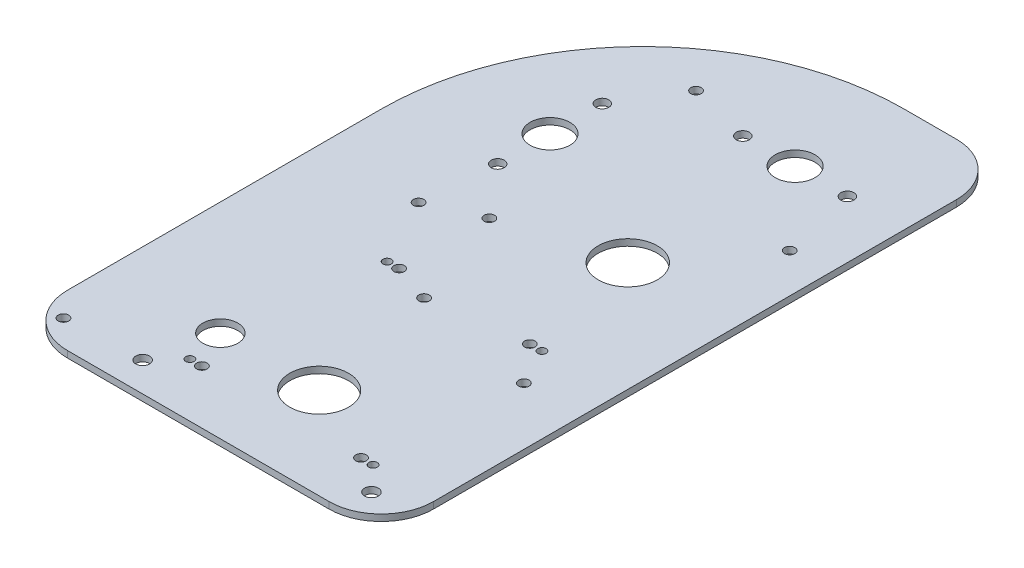
from build123d import *

# Parameters (mm, degrees)
SKETCH1_W                  = 355.6
SKETCH1_H                  = 77.724
BOSS_EXTRUDE1_DEPTH        = 22.225
SKETCH2_W                  = 74.549
SKETCH2_H                  = 19.05
CUT_EXTRUDE1_DEPTH         = 364.67400769
SKETCH3_W                  = 25.4
SKETCH3_H                  = 3.937
CUT_EXTRUDE2_DEPTH         = 817.444922817
SKETCH4_W                  = 330.2
SKETCH4_H                  = 3.175
BOSS_EXTRUDE2_DEPTH        = 15.875
SKETCH5_W                  = 69.85
SKETCH5_H                  = 3.175
BOSS_EXTRUDE3_DEPTH        = 457.2
SKETCH6_W                  = 330.2
SKETCH6_H                  = 3.175
BOSS_EXTRUDE4_DEPTH        = 3.937
SKETCH7_W                  = 330.2
SKETCH7_H                  = 3.175
BOSS_EXTRUDE5_DEPTH        = 15.875
SKETCH8_W                  = 355.6
SKETCH8_H                  = 3.175
BOSS_EXTRUDE6_DEPTH        = 3.937
SKETCH9_W                  = 355.6
SKETCH9_H                  = 3.175
BOSS_EXTRUDE7_DEPTH        = 19.05
SKETCH10_W                 = 76.358809824
SKETCH10_H                 = 3.175
BOSS_EXTRUDE8_DEPTH        = 27.432
SKETCH11_W                 = 124.052954744
SKETCH11_H                 = 3.175
BOSS_EXTRUDE9_DEPTH        = 19.05
DRAFT1_ANGLE               = 30
DRAFT2_ANGLE               = 19
M20_CLEARANCE_HOLE1_D      = 22.225
M20_CLEARANCE_HOLE1_DEPTH  = 19.050025
HOLE1_D                    = 8.128
HOLE1_DEPTH                = 22.225
M25_CLEARANCE_HOLE1_D      = 28.575
M25_CLEARANCE_HOLE1_DEPTH  = 22.225
M3_CLEARANCE_HOLE1_D       = 3.571875
M3_CLEARANCE_HOLE1_DEPTH   = 22.225
M2_CLEARANCE_HOLE1_D       = 2.54
M2_CLEARANCE_HOLE1_DEPTH   = 22.225
M3_5_CLEARANCE_HOLE1_D     = 4.064
M3_5_CLEARANCE_HOLE1_DEPTH = 22.225
HOLE2_D                    = 5.08
HOLE2_DEPTH                = 22.225
M25_CLEARANCE_HOLE2_D      = 28.575
M25_CLEARANCE_HOLE2_DEPTH  = 19.050025
HOLE3_D                    = 5.1054
HOLE3_DEPTH                = 19.050025
HOLE4_D                    = 8.128
HOLE4_DEPTH                = 19.050025
M3_CLEARANCE_HOLE2_D       = 3.571875
M3_CLEARANCE_HOLE2_DEPTH   = 19.050025
M6_CLEARANCE_HOLE1_D       = 6.7056
M6_CLEARANCE_HOLE1_DEPTH   = 22.225
M6_CLEARANCE_HOLE2_D       = 6.7056
M6_CLEARANCE_HOLE2_DEPTH   = 101.219
M5_CLEARANCE_HOLE1_D       = 5.334
M5_CLEARANCE_HOLE1_DEPTH   = 92.837
CHAMFER1_SIZE              = 3.175
FILLET1_R                  = 0.762
FILLET2_R                  = 3.175
FILLET3_R                  = 3.937
CUT_EXTRUDE3_DEPTH         = 819.902667079
CUT_EXTRUDE3_DEPTH_BACK    = 819.902667079
BOSS_EXTRUDE10_START       = -3.175
SKETCH45_W                 = 177.8
SKETCH45_H                 = 304.8
SKETCH45_R                 = 2.54
SKETCH45_R_2               = 14.2875
SKETCH45_R_3               = 2.032
SKETCH45_R_4               = 3.3528
BOSS_EXTRUDE10_DEPTH       = 3.175
SKETCH61_R                 = 9.652
SKETCH61_R_2               = 14.351
CUT_EXTRUDE16_DEPTH        = 556.389125447
SKETCH59_R                 = 9.5
CUT_EXTRUDE17_DEPTH        = 556.389125447
SKETCH62_R                 = 3.175
CUT_EXTRUDE18_DEPTH        = 556.389125447
CUT_EXTRUDE19_DEPTH        = 556.389125447
SKETCH70_R                 = 9.5
SKETCH70_R_2               = 8.5
BOSS_EXTRUDE15_DEPTH       = 3.175
SKETCH73_R                 = 2.54
CUT_EXTRUDE21_DEPTH        = 556.389125447
FILLET9_R                  = 25.4
CUT_EXTRUDE23_DEPTH        = 556.389125447
CUT_EXTRUDE23_DEPTH_BACK   = 556.389125447
SKETCH76_R                 = 2.54


with BuildPart() as part:
    # Sketch1 → Boss-Extrude1 (new body)
    with BuildSketch(Plane(origin=(0, 3.175, 0), x_dir=(1, 0, 0), z_dir=(0, 1, 0))):
        with Locations((635, 34.925)):
            Rectangle(SKETCH1_W, SKETCH1_H)
    extrude(amount=-BOSS_EXTRUDE1_DEPTH)

    # Sketch2 → Cut-Extrude1 (cut, through all)
    with BuildSketch(Plane(origin=(812.8, 0, 0), x_dir=(0, 0, -1), z_dir=(1, 0, 0))):
        with Locations((33.3375, -9.525)):
            Rectangle(SKETCH2_W, SKETCH2_H)
    extrude(amount=-CUT_EXTRUDE1_DEPTH, mode=Mode.SUBTRACT)

    # Sketch3 → Cut-Extrude2 (cut, through all)
    with BuildSketch(Plane(origin=(0, 3.175, 0), x_dir=(-1, 0, 0), z_dir=(0, 1, 0))):
        with Locations((-469.9, 1.9685)):
            Rectangle(SKETCH3_W, SKETCH3_H)
    extrude(amount=-CUT_EXTRUDE2_DEPTH, mode=Mode.SUBTRACT)

    # Sketch4 → Boss-Extrude2 (add)
    with BuildSketch(Plane(origin=(0, 3.175, 0), x_dir=(-1, 0, 0), z_dir=(0, 1, 0))):
        with Locations((-647.7, 2.3495)):
            Rectangle(SKETCH4_W, SKETCH4_H)
    extrude(amount=BOSS_EXTRUDE2_DEPTH)

    # Sketch5 → Boss-Extrude3 (add)
    with BuildSketch(Plane.ZY.offset(-457.2)):
        with Locations((-34.925, 1.5875)):
            Rectangle(SKETCH5_W, SKETCH5_H)
    extrude(amount=BOSS_EXTRUDE3_DEPTH)

    # Sketch6 → Boss-Extrude4 (add)
    with BuildSketch(Plane.XY):
        with Locations((165.1, 1.5875)):
            Rectangle(SKETCH6_W, SKETCH6_H)
    extrude(amount=BOSS_EXTRUDE4_DEPTH)

    # Sketch7 → Boss-Extrude5 (add)
    with BuildSketch(Plane(origin=(0, 3.175, 0), x_dir=(-1, 0, 0), z_dir=(0, 1, 0))):
        with Locations((-165.1, 2.3495)):
            Rectangle(SKETCH7_W, SKETCH7_H)
    extrude(amount=BOSS_EXTRUDE5_DEPTH)

    # Sketch8 → Boss-Extrude6 (add)
    with BuildSketch(Plane(origin=(0, 0, -69.85), x_dir=(-1, 0, 0), z_dir=(0, 0, -1))):
        with Locations((-177.8, 1.5875)):
            Rectangle(SKETCH8_W, SKETCH8_H)
    extrude(amount=BOSS_EXTRUDE6_DEPTH)

    # Sketch9 → Boss-Extrude7 (add)
    with BuildSketch(Plane.XZ):
        with Locations((177.8, -72.1995)):
            Rectangle(SKETCH9_W, SKETCH9_H)
    extrude(amount=BOSS_EXTRUDE7_DEPTH)

    # Sketch10 → Boss-Extrude8 (add)
    with BuildSketch(Plane(origin=(0, 0, -69.85), x_dir=(-1, 0, 0), z_dir=(0, 0, -1))):
        with Locations((-406.4, 1.5875)):
            Rectangle(SKETCH10_W, SKETCH10_H)
    extrude(amount=BOSS_EXTRUDE8_DEPTH)

    # Sketch11 → Boss-Extrude9 (add)
    with BuildSketch(Plane.XY):
        with Locations((406.4, 1.5875)):
            Rectangle(SKETCH11_W, SKETCH11_H)
    extrude(amount=BOSS_EXTRUDE9_DEPTH)

    # Draft1
    draft1_faces = [part.faces().sort_by_distance(p)[0] for p in [
        (344.373522628, 1.5875, 9.525),
        (468.426477372, 1.5875, 9.525),
    ]]
    draft(draft1_faces, Plane.XY.offset(19.05), DRAFT1_ANGLE)

    # Draft2
    draft2_faces = [part.faces().sort_by_distance(p)[0] for p in [
        (368.220595088, 1.5875, -83.566),
        (444.579404912, 1.5875, -83.566),
    ]]
    draft(draft2_faces, Plane(origin=(0, 0, -97.282), x_dir=(-1, 0, 0), z_dir=(0, 0, -1)), DRAFT2_ANGLE)

    # M20 Clearance Hole1
    with Locations(Plane(origin=(0, 0, 0), x_dir=(-1, 0, 0), z_dir=(0, -1, 0))):
        with Locations((-624.254637168, 36.83)):
            Hole(M20_CLEARANCE_HOLE1_D / 2, depth=M20_CLEARANCE_HOLE1_DEPTH)

    # Hole1
    with Locations(Plane(origin=(0, 3.175, 0), x_dir=(1, 0, 0), z_dir=(0, 1, 0))):
        with Locations((229.261562832, 36.83), (229.261562832, 62.23), (229.261562832, 11.43)):
            Hole(HOLE1_D / 2, depth=HOLE1_DEPTH)

    # M25 Clearance Hole1
    with Locations(Plane(origin=(0, 3.175, 0), x_dir=(1, 0, 0), z_dir=(0, 1, 0))):
        with Locations((147.829162832, 36.83)):
            Hole(M25_CLEARANCE_HOLE1_D / 2, depth=M25_CLEARANCE_HOLE1_DEPTH)

    # M3 Clearance Hole1
    with Locations(Plane(origin=(0, 3.175, 0), x_dir=(1, 0, 0), z_dir=(0, 1, 0))):
        with Locations((120.600362832, 65.405), (120.600362832, 8.255), (237.440362832, 8.255), (237.440362832, 65.405)):
            Hole(M3_CLEARANCE_HOLE1_D / 2, depth=M3_CLEARANCE_HOLE1_DEPTH)

    # M2 Clearance Hole1
    with Locations(Plane(origin=(0, 3.175, 0), x_dir=(1, 0, 0), z_dir=(0, 1, 0))):
        with Locations((101.6, 3.175), (101.6, 66.675), (50.8, 66.675), (50.8, 3.175), (762, 66.675), (762, 3.175), (711.2, 3.175), (711.2, 66.675)):
            Hole(M2_CLEARANCE_HOLE1_D / 2, depth=M2_CLEARANCE_HOLE1_DEPTH)

    # M3.5 Clearance Hole1
    with Locations(Plane(origin=(0, 3.175, 0), x_dir=(1, 0, 0), z_dir=(0, 1, 0))):
        with Locations((443.992, 87.85352), (368.808, 87.85352), (361.9119, -1.03886), (450.8881, -1.03886)):
            Hole(M3_5_CLEARANCE_HOLE1_D / 2, depth=M3_5_CLEARANCE_HOLE1_DEPTH)

    # Hole2
    with Locations(Plane(origin=(0, 3.175, 0), x_dir=(1, 0, 0), z_dir=(0, 1, 0))):
        with Locations((438.15, 87.85352), (374.65, 87.85352), (445.0461, -1.03886), (367.7539, -1.03886), (115.520362832, 65.405), (115.520362832, 8.255), (242.520362832, 8.255), (242.520362832, 65.405)):
            Hole(HOLE2_D / 2, depth=HOLE2_DEPTH)

    # M25 Clearance Hole2
    with Locations(Plane(origin=(0, 0, 0), x_dir=(-1, 0, 0), z_dir=(0, -1, 0))):
        with Locations((-406.4, 17.272), (-664.970837168, 36.83)):
            Hole(M25_CLEARANCE_HOLE2_D / 2, depth=M25_CLEARANCE_HOLE2_DEPTH)

    # Hole3
    with Locations(Plane(origin=(0, 0, 0), x_dir=(-1, 0, 0), z_dir=(0, -1, 0))):
        with Locations((-570.279637168, 8.255), (-570.279637168, 65.405), (-697.279637168, 65.405), (-697.279637168, 8.255)):
            Hole(HOLE3_D / 2, depth=HOLE3_DEPTH)

    # Hole4
    with Locations(Plane(origin=(0, 0, 0), x_dir=(-1, 0, 0), z_dir=(0, -1, 0))):
        with Locations((-583.538437168, 11.43), (-583.538437168, 36.83), (-583.538437168, 62.23)):
            Hole(HOLE4_D / 2, depth=HOLE4_DEPTH)

    # M3 Clearance Hole2
    with Locations(Plane(origin=(0, 0, 0), x_dir=(-1, 0, 0), z_dir=(0, -1, 0))):
        with Locations((-692.199637168, 8.255), (-692.199637168, 65.405), (-575.359637168, 65.405), (-575.359637168, 8.255)):
            Hole(M3_CLEARANCE_HOLE2_D / 2, depth=M3_CLEARANCE_HOLE2_DEPTH)

    # M6 Clearance Hole1
    with Locations(Plane(origin=(0, 3.175, 0), x_dir=(1, 0, 0), z_dir=(0, 1, 0))):
        with Locations((612.775, 10.287), (498.475, 10.287), (314.325, 10.287), (200.025, 10.287), (628.319218584, 61.976), (184.480781416, 61.976), (690.88, 15.875), (739.902, 9.525), (121.92, 15.875), (72.898, 9.525), (298.874532383, 17.547282407), (513.925467617, 17.547282407), (165.1, 14.732), (266.7, 14.732), (546.1, 14.732), (647.7, 14.732), (330.2, 61.722), (279.4, 61.722), (139.7, 61.722), (25.4, 61.722), (482.6, 61.722), (533.4, 61.722), (673.1, 61.722), (787.4, 61.722), (6.35, 39.497), (806.45, 39.497), (350.8375, -12.8905), (461.9625, -12.8905)):
            Hole(M6_CLEARANCE_HOLE1_D / 2, depth=M6_CLEARANCE_HOLE1_DEPTH)

    # M6 Clearance Hole2
    with Locations(Plane.XY.offset(3.937)):
        with Locations((495.3, 12.7), (520.7, 12.7), (546.1, 12.7), (571.5, 12.7), (596.9, 12.7), (622.3, 12.7), (647.7, 12.7), (673.1, 12.7), (698.5, 12.7), (723.9, 12.7), (749.3, 12.7), (774.7, 12.7), (800.1, 12.7), (317.5, 12.7), (292.1, 12.7), (266.7, 12.7), (241.3, 12.7), (215.9, 12.7), (190.5, 12.7), (165.1, 12.7), (139.7, 12.7), (114.3, 12.7), (88.9, 12.7), (63.5, 12.7), (12.7, 12.7), (38.1, 12.7)):
            Hole(M6_CLEARANCE_HOLE2_D / 2, depth=M6_CLEARANCE_HOLE2_DEPTH)

    # M5 Clearance Hole1
    with Locations(Plane(origin=(0, 0, -73.787), x_dir=(-1, 0, 0), z_dir=(0, 0, -1))):
        with Locations((-469.9, -12.7), (-495.3, -12.7), (-520.7, -12.7), (-546.1, -12.7), (-571.5, -12.7), (-596.9, -12.7), (-622.3, -12.7), (-647.7, -12.7), (-673.1, -12.7), (-698.5, -12.7), (-723.9, -12.7), (-749.3, -12.7), (-774.7, -12.7), (-800.1, -12.7), (-342.9, -12.7), (-317.5, -12.7), (-292.1, -12.7), (-266.7, -12.7), (-241.3, -12.7), (-215.9, -12.7), (-190.5, -12.7), (-165.1, -12.7), (-139.7, -12.7), (-114.3, -12.7), (-88.9, -12.7), (-63.5, -12.7), (-38.1, -12.7), (-12.7, -12.7)):
            Hole(M5_CLEARANCE_HOLE1_D / 2, depth=M5_CLEARANCE_HOLE1_DEPTH)

    # Chamfer1
    chamfer1_edges = [part.edges().sort_by_distance(p)[0] for p in [
        (482.6, 19.05, 2.3495),
        (0, 19.05, 2.3495),
        (812.8, 19.05, 2.3495),
        (812.8, -19.05, -72.1995),
        (457.2, -19.05, -72.1995),
        (0, -19.05, -72.1995),
        (330.2, 19.05, 2.3495),
        (355.6, -19.05, -72.1995),
    ]]
    chamfer(chamfer1_edges, length=CHAMFER1_SIZE)

    # Fillet1
    fillet1_edges = [part.edges().sort_by_distance(p)[0] for p in [
        (647.7, 3.175, 0.762),
        (177.8, 0, -70.612),
        (635, 0, -70.612),
        (165.1, 3.175, 0.762),
    ]]
    fillet(fillet1_edges, radius=FILLET1_R)

    # Fillet2
    fillet2_edges = [part.edges().sort_by_distance(p)[0] for p in [
        (368.220595088, 1.5875, -97.282),
        (333.375, 1.5875, 0),
        (344.373522628, 1.5875, 19.05),
        (444.579404912, 1.5875, -97.282),
        (358.775, 1.5875, -69.85),
        (479.425, 1.5875, 0),
        (468.426477372, 1.5875, 19.05),
        (454.025, 1.5875, -69.85),
    ]]
    fillet(fillet2_edges, radius=FILLET2_R)

    # Fillet3
    fillet3_edges = [part.edges().sort_by_distance(p)[0] for p in [
        (165.1, 0, 3.937),
        (647.7, 0, 3.937),
        (635, 3.175, -73.787),
        (177.8, 3.175, -73.787),
    ]]
    fillet(fillet3_edges, radius=FILLET3_R)

    # Sketch44 → Cut-Extrude3 (cut, two sides: drawn at the far end of the back side and taken through both)
    with BuildSketch(Plane(origin=(0, 3.175, 0), x_dir=(1, 0, 0), z_dir=(0, 1, 0)).offset(-CUT_EXTRUDE3_DEPTH_BACK)):
        Polygon((367.483279101, 95.14067889), (343.456979076, -17.4625), (339.564298226, -35.70618453), (-19.786749283, -35.70618453), (-19.786749283, 120.609234526), (367.483279101, 120.609234526), align=None)
        Polygon((445.316720899, 95.14067889), (445.316720899, 120.609234526), (832.586749283, 120.609234526), (832.586749283, -35.70618453), (473.235701774, -35.70618453), (469.343020924, -17.4625), align=None)
    extrude(amount=CUT_EXTRUDE3_DEPTH + CUT_EXTRUDE3_DEPTH_BACK, mode=Mode.SUBTRACT)

    # Sketch45 → Boss-Extrude10 (add)
    with BuildSketch(Plane(origin=(0, 3.175, 0), x_dir=(1, 0, 0), z_dir=(0, 1, 0)).offset(BOSS_EXTRUDE10_START)):
        with Locations((392.1125, 125.222)):
            Rectangle(SKETCH45_W, SKETCH45_H)
        with Locations(Location((374.65, 87.85352, 0), (0, 0, 270))):
            Circle(SKETCH45_R, mode=Mode.SUBTRACT)
        with Locations(Location((406.4, 17.272, 0), (0, 0, 90))):
            Circle(SKETCH45_R_2, mode=Mode.SUBTRACT)
        with Locations(Location((368.808, 87.85352, 0), (0, 0, 270))):
            Circle(SKETCH45_R_3, mode=Mode.SUBTRACT)
        with Locations(Location((438.15, 87.85352, 0), (0, 0, 270))):
            Circle(SKETCH45_R, mode=Mode.SUBTRACT)
        with Locations(Location((443.992, 87.85352, 0), (0, 0, 270))):
            Circle(SKETCH45_R_3, mode=Mode.SUBTRACT)
        with Locations(Location((445.0461, -1.03886, 0), (0, 0, 270))):
            Circle(SKETCH45_R, mode=Mode.SUBTRACT)
        with Locations(Location((450.8881, -1.03886, 0), (0, 0, 270))):
            Circle(SKETCH45_R_3, mode=Mode.SUBTRACT)
        with Locations(Location((461.9625, -12.8905, 0), (0, 0, 270))):
            Circle(SKETCH45_R_4, mode=Mode.SUBTRACT)
        with Locations(Location((367.7539, -1.03886, 0), (0, 0, 270))):
            Circle(SKETCH45_R, mode=Mode.SUBTRACT)
        with Locations(Location((361.9119, -1.03886, 0), (0, 0, 270))):
            Circle(SKETCH45_R_3, mode=Mode.SUBTRACT)
        with Locations(Location((350.8375, -12.8905, 0), (0, 0, 270))):
            Circle(SKETCH45_R_4, mode=Mode.SUBTRACT)
    extrude(amount=BOSS_EXTRUDE10_DEPTH)

    # Sketch61 → Cut-Extrude16 (cut, through all)
    with BuildSketch(Plane(origin=(0, 3.175, 0), x_dir=(1, 0, 0), z_dir=(0, 1, 0))):
        with Locations(Location((354.59, 181.205026561, 0), (0, 0, 270))):
            Circle(SKETCH61_R)
        with Locations(Location((427.755496639, 227.083776561, 0), (0, 0, 270))):
            Circle(SKETCH61_R)
        with Locations(Location((427.755496639, 145.803776561, 0), (0, 0, 270))):
            Circle(SKETCH61_R_2)
    extrude(amount=-CUT_EXTRUDE16_DEPTH, mode=Mode.SUBTRACT)

    # Sketch59 → Cut-Extrude17 (cut, through all)
    with BuildSketch(Plane(origin=(0, 3.175, 0), x_dir=(1, 0, 0), z_dir=(0, 1, 0))):
        with Locations(Location((358.4, 17.272, 0), (0, 0, 270))):
            Circle(SKETCH59_R)
    extrude(amount=-CUT_EXTRUDE17_DEPTH, mode=Mode.SUBTRACT)

    # Sketch62 → Cut-Extrude18 (cut, through all)
    with BuildSketch(Plane(origin=(0, 3.175, 0), x_dir=(1, 0, 0), z_dir=(0, 1, 0))):
        with Locations(Location((354.59, 206.605026561, 0), (0, 0, 270))):
            Circle(SKETCH62_R)
        with Locations(Location((354.59, 155.805026561, 0), (0, 0, 270))):
            Circle(SKETCH62_R)
        with Locations(Location((402.355496639, 227.083776561, 0), (0, 0, 270))):
            Circle(SKETCH62_R)
        with Locations(Location((453.155496639, 227.083776561, 0), (0, 0, 270))):
            Circle(SKETCH62_R)
    extrude(amount=-CUT_EXTRUDE18_DEPTH, mode=Mode.SUBTRACT)

    # Sketch64 → Cut-Extrude19 (cut, through all)
    with BuildSketch(Plane(origin=(0, 3.175, 0), x_dir=(1, 0, 0), z_dir=(0, 1, 0))):
        with BuildLine():
            Line((303.2125, 150.622), (303.2125, 277.622))
            Line((303.2125, 277.622), (430.2125, 277.622))
            ThreePointArc((430.2125, 277.622), (340.409938789, 240.424561211), (303.2125, 150.622))
        make_face()
    extrude(amount=-CUT_EXTRUDE19_DEPTH, mode=Mode.SUBTRACT)

    # Sketch70 → Boss-Extrude15 (add)
    with BuildSketch(Plane(origin=(0, 3.175, 0), x_dir=(1, 0, 0), z_dir=(0, 1, 0))):
        with Locations((358.4, 17.272)):
            Circle(SKETCH70_R)
        with Locations(Location((358.4, 17.272, 0), (0, 0, 270))):
            Circle(SKETCH70_R_2, mode=Mode.SUBTRACT)
    extrude(amount=-BOSS_EXTRUDE15_DEPTH)

    # Sketch73 → Cut-Extrude21 (cut, through all)
    with BuildSketch(Plane(origin=(0, 3.175, 0), x_dir=(1, 0, 0), z_dir=(0, 1, 0))):
        with Locations(Location((453.155496639, 69.943578721, 0), (0, 0, 270))):
            Circle(SKETCH73_R)
        with Locations(Location((461.9625, 190.253776561, 0), (0, 0, 270))):
            Circle(SKETCH73_R)
        with Locations(Location((351.555496639, 120.403776561, 0), (0, 0, 270))):
            Circle(SKETCH73_R)
        with Locations(Location((393.07774832, 81.537888281, 0), (0, 0, 270))):
            Circle(SKETCH73_R)
        with Locations(Location((313.95, -14.478, 0), (0, 0, 270))):
            Circle(SKETCH73_R)
    extrude(amount=-CUT_EXTRUDE21_DEPTH, mode=Mode.SUBTRACT)

    # Fillet9
    fillet9_edges = [part.edges().sort_by_distance(p)[0] for p in [
        (303.2125, 1.5875, 27.178),
        (481.0125, 1.5875, 27.178),
        (481.0125, 1.5875, -277.622),
    ]]
    fillet(fillet9_edges, radius=FILLET9_R)

    # Sketch76 → Cut-Extrude23 (cut, two sides: drawn at the far end of the back side and taken through both)
    with BuildSketch(Plane(origin=(0, 3.175, 0), x_dir=(1, 0, 0), z_dir=(0, 1, 0)).offset(-CUT_EXTRUDE23_DEPTH_BACK)):
        with Locations(Location((371.94415457, 234.809352358, 0), (0, 0, 270))):
            Circle(SKETCH76_R)
        with Locations(Location((375.408129179, 130.922891339, 0), (0, 0, 270))):
            Circle(SKETCH76_R)
    extrude(amount=CUT_EXTRUDE23_DEPTH + CUT_EXTRUDE23_DEPTH_BACK, mode=Mode.SUBTRACT)


solid = part.part
